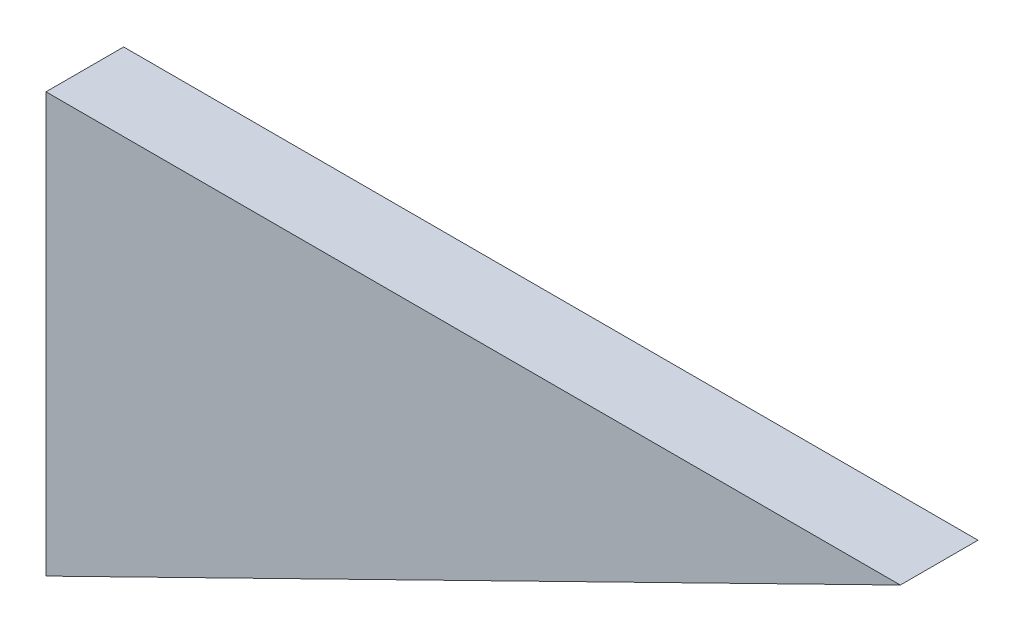
from build123d import *

# Parameters (mm, degrees)
SUPPORT_GUSSET_DEPTH = 5


with BuildPart() as part:
    # 草图1 → Support_gusset (new body)
    with BuildSketch(Plane.XY):
        Polygon((0, 0), (55, 0), (0, -27), align=None)
    extrude(amount=SUPPORT_GUSSET_DEPTH)


solid = part.part
